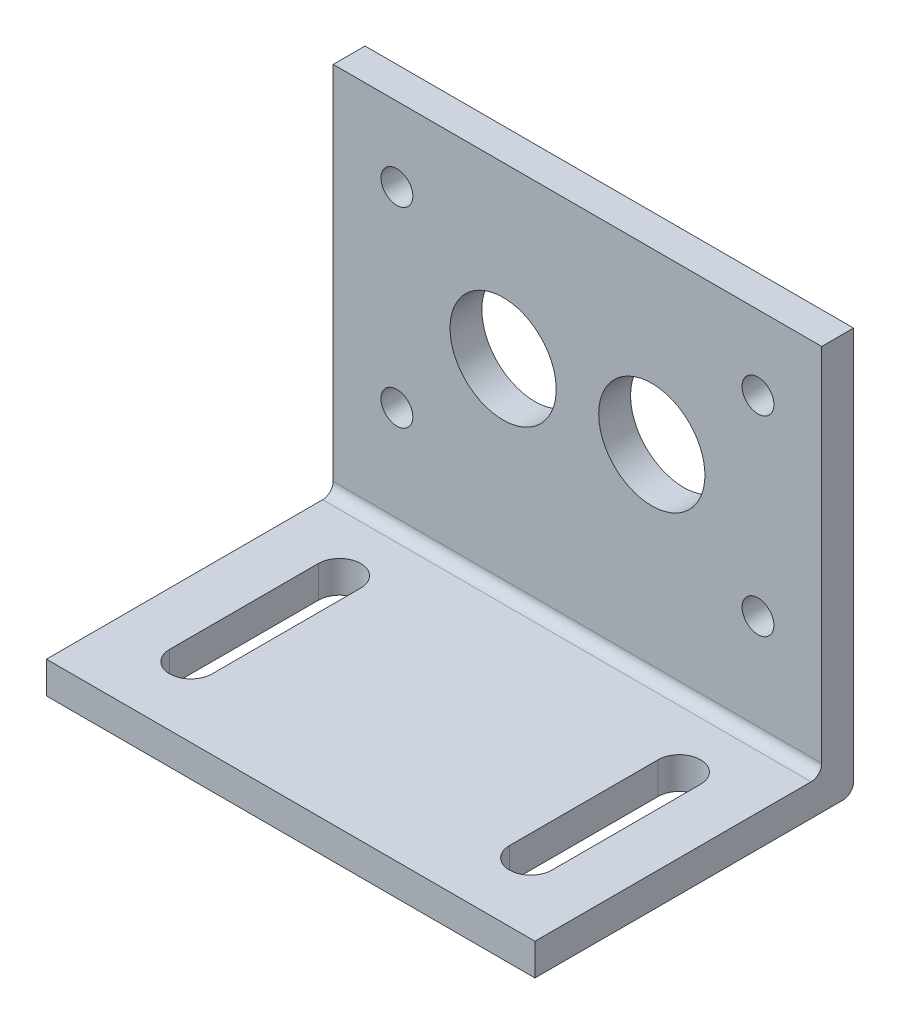
from build123d import *

# Parameters (mm, degrees)
SKETCH_1_W          = 46
SKETCH_1_H          = 30
EXTRUDE_1_DEPTH     = 3
SKETCH_2_W          = 46
SKETCH_2_H          = 38
EXTRUDE_2_DEPTH     = 3
FILLET_1_R          = 1
SKETCH_3_R          = 1.5
SKETCH_3_R_2        = 5
CUT_EXTRUDE_1_DEPTH = 3
CUT_EXTRUDE_2_DEPTH = 3


with BuildPart() as part:
    # 草图1 → 凸台-拉伸1 (new body)
    with BuildSketch(Plane(origin=(0, 0, 0), x_dir=(1, 0, 0), z_dir=(0, 1, 0))):
        Rectangle(SKETCH_1_W, SKETCH_1_H)
    extrude(amount=EXTRUDE_1_DEPTH)

    # 草图2 → 凸台-拉伸2 (add)
    with BuildSketch(Plane(origin=(0, 0, -15), x_dir=(-1, 0, 0), z_dir=(0, 0, -1))):
        with Locations((0, 19)):
            Rectangle(SKETCH_2_W, SKETCH_2_H)
    extrude(amount=-EXTRUDE_2_DEPTH)

    # 圆角1
    fillet_1_edges = [part.edges().sort_by_distance(p)[0] for p in [
        (0, 3, -12),
        (0, 0, -15),
    ]]
    fillet(fillet_1_edges, radius=FILLET_1_R)

    # 草图3 → 切除-拉伸1 (cut)
    with BuildSketch(Plane(origin=(0, 0, -15), x_dir=(-1, 0, 0), z_dir=(0, 0, -1))):
        with Locations((17, 13)):
            Circle(SKETCH_3_R)
        with Locations((17, 31)):
            Circle(SKETCH_3_R)
        with Locations((-17, 31)):
            Circle(SKETCH_3_R)
        with Locations((-17, 13)):
            Circle(SKETCH_3_R)
        with Locations((7, 22)):
            Circle(SKETCH_3_R_2)
        with Locations((-7, 22)):
            Circle(SKETCH_3_R_2)
    extrude(amount=-CUT_EXTRUDE_1_DEPTH, mode=Mode.SUBTRACT)

    # 草图4 → 切除-拉伸2 (cut)
    with BuildSketch(Plane(origin=(0, 3, 0), x_dir=(1, 0, 0), z_dir=(0, 1, 0))):
        with BuildLine():
            Line((-18, -8.4), (-18, 5.6))
            ThreePointArc((-18, 5.6), (-16, 7.6), (-14, 5.6))
            Line((-14, 5.6), (-14, -8.4))
            ThreePointArc((-14, -8.4), (-16, -10.4), (-18, -8.4))
        make_face()
        with BuildLine():
            Line((18, -8.4), (18, 5.6))
            ThreePointArc((18, 5.6), (16, 7.6), (14, 5.6))
            Line((14, 5.6), (14, -8.4))
            ThreePointArc((14, -8.4), (16, -10.4), (18, -8.4))
        make_face()
    extrude(amount=-CUT_EXTRUDE_2_DEPTH, mode=Mode.SUBTRACT)


solid = part.part
